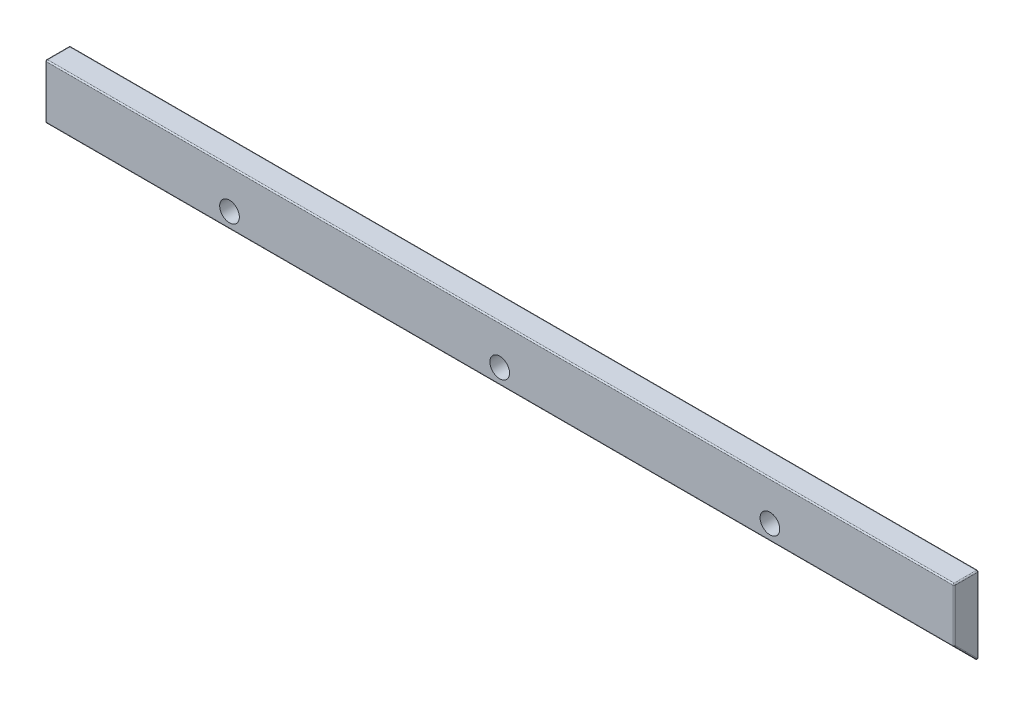
from build123d import *

# Parameters (mm, degrees)
BOSS_EXTRUDE1_DEPTH      = 37
BOSS_EXTRUDE1_DEPTH_BACK = 37
FILLET1_R                = 0.1
M2X0_4_TAPPED_HOLE1_D    = 1.6


with BuildPart() as part:
    # Sketch1 → Boss-Extrude1 (new, two sides: drawn at the far end of the back side and taken through both)
    with BuildSketch(Plane(origin=(0, 0, 0), x_dir=(0, 0, -1), z_dir=(1, 0, 0)).offset(-BOSS_EXTRUDE1_DEPTH_BACK)):
        Polygon((0, -3.2), (-2, -1.2), (-2, 3.2), (0, 3.2), align=None)
    extrude(amount=BOSS_EXTRUDE1_DEPTH + BOSS_EXTRUDE1_DEPTH_BACK)

    # Fillet1
    fillet1_edges = [part.edges().sort_by_distance(p)[0] for p in [
        (-37, -2.2, 1),
        (-37, 0, 0),
        (0, 3.2, 2),
        (0, -1.2, 2),
        (37, -2.2, 1),
        (37, 0, 0),
        (37, 3.2, 1),
        (37, 1, 2),
        (0, -3.2, 0),
        (0, 3.2, 0),
        (-37, 3.2, 1),
        (-37, 1, 2),
    ]]
    fillet(fillet1_edges, radius=FILLET1_R)

    # M2x0.4 Tapped Hole1 (through all)
    with Locations(Plane.XY.offset(2)):
        with Locations((22, 0), (0, 0), (-22, 0)):
            Hole(M2X0_4_TAPPED_HOLE1_D / 2)


solid = part.part
